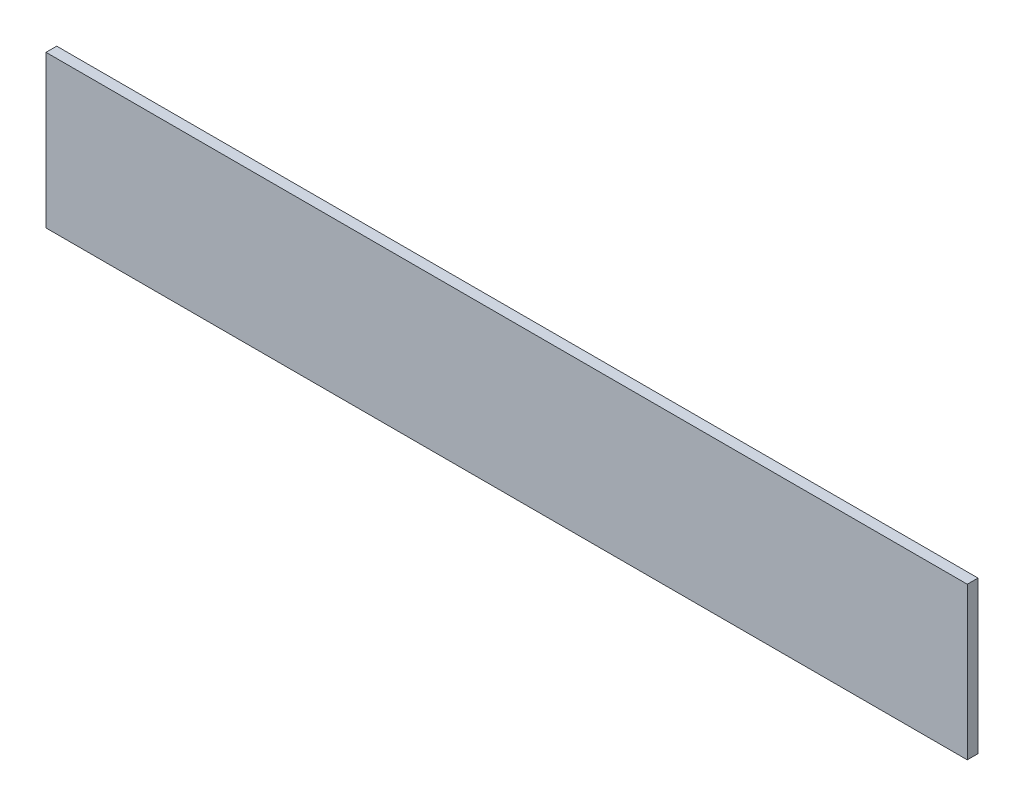
from build123d import *

# Parameters (mm, degrees)
CROQUIS1_W              = 430
CROQUIS1_H              = 71
SALIENTE_EXTRUIR1_DEPTH = 5


with BuildPart() as part:
    # Croquis1 → Saliente-Extruir1 (new body)
    with BuildSketch(Plane.XY):
        with Locations((140.882485767, 11.150641026)):
            Rectangle(CROQUIS1_W, CROQUIS1_H)
    extrude(amount=SALIENTE_EXTRUIR1_DEPTH)


solid = part.part
